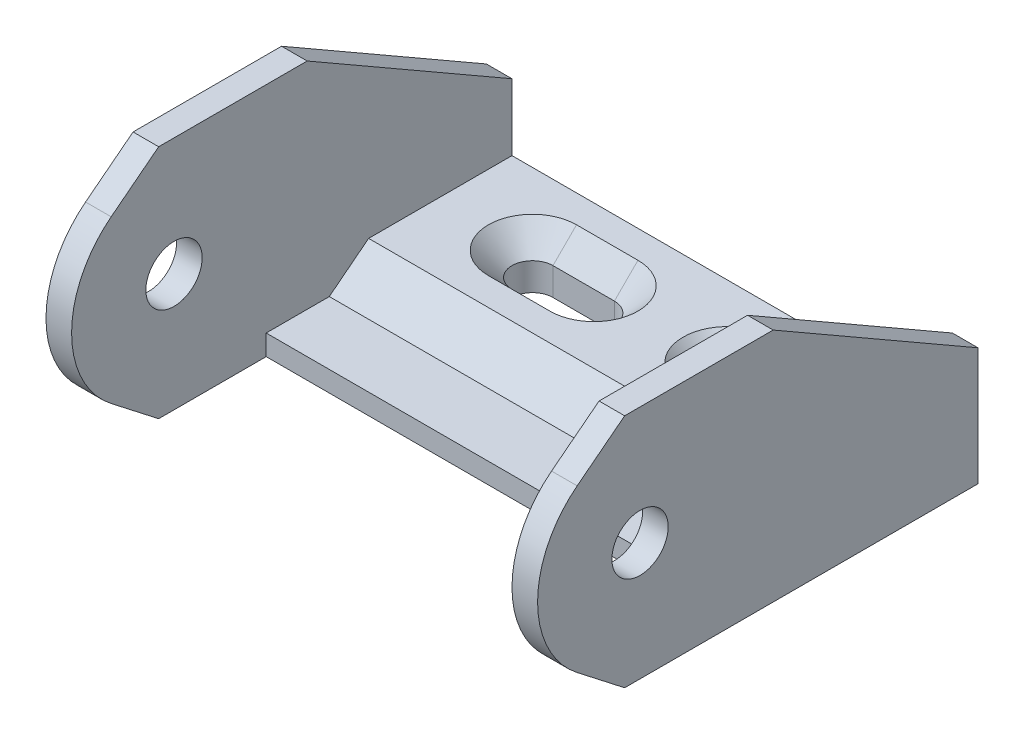
from build123d import *

# Parameters (mm, degrees)
BOSS_EXTRUDE1_DEPTH      = 24
SKETCH2_R                = 2.75
CUT_EXTRUDE1_DEPTH       = 48
CUT_EXTRUDE2_DEPTH       = 21.5
CUT_EXTRUDE3_DEPTH       = 40.535585237
CHAMFER1_SIZE            = 2.3
CHAMFER1_OF_MIRROR1_SIZE = 2.3


with BuildPart() as part:
    # Sketch1 → Boss-Extrude1 (new, symmetric)
    with BuildSketch(Plane(origin=(0, 0, 0), x_dir=(0, 0, -1), z_dir=(1, 0, 0))):
        with BuildLine():
            Line((-17.25, 11.5), (-21.887338715, 7.895129733))
            ThreePointArc((-21.887338715, 7.895129733), (-25.75, 0), (-21.887338715, -7.895129733))
            Line((-21.887338715, -7.895129733), (-17.25, -11.5))
            Line((-17.25, -11.5), (17.25, -11.5))
            Line((17.25, -11.5), (17.25, 11.5))
            Line((17.25, 11.5), (-17.25, 11.5))
        make_face()
    extrude(amount=BOSS_EXTRUDE1_DEPTH, both=True)

    # Sketch2 → Cut-Extrude1 (cut)
    with BuildSketch(Plane(origin=(24, 0, 0), x_dir=(0, 0, -1), z_dir=(1, 0, 0))):
        with Locations((-15.75, 0)):
            Circle(SKETCH2_R)
        Polygon((17.25, 0), (-2.75, 11.5), (17.25, 11.5), align=None)
    extrude(amount=-CUT_EXTRUDE1_DEPTH, mode=Mode.SUBTRACT)

    # Sketch4 → Cut-Extrude2 (cut, symmetric)
    with BuildSketch(Plane(origin=(0, 0, 0), x_dir=(0, 0, -1), z_dir=(1, 0, 0))):
        with BuildLine():
            Line((17.25, -6.5), (17.25, 0))
            Line((17.25, 0), (-2.75, 11.5))
            Line((-2.75, 11.5), (-17.25, 11.5))
            Line((-17.25, 11.5), (-21.887338715, 7.895129733))
            ThreePointArc((-21.887338715, 7.895129733), (-25.75, 0), (-21.887338715, -7.895129733))
            Line((-21.887338715, -7.895129733), (-17.25, -11.5))
            Line((-17.25, -11.5), (-6.75, -11.5))
            Line((-6.75, -11.5), (-6.75, -9.5))
            Line((-6.75, -9.5), (-0.589824897, -9.5))
            Line((-0.589824897, -9.5), (3.25, -6.5))
            Line((3.25, -6.5), (17.25, -6.5))
        make_face()
    extrude(amount=CUT_EXTRUDE2_DEPTH, both=True, mode=Mode.SUBTRACT)

    # Sketch5 → Cut-Extrude3 (cut, through all)
    with BuildSketch(Plane(origin=(0, -6.5, 0), x_dir=(1, 0, 0), z_dir=(0, 1, 0))):
        with BuildLine():
            Line((6.5, 12.25), (12.5, 12.25))
            ThreePointArc((12.5, 12.25), (14.5, 10.25), (12.5, 8.25))
            Line((12.5, 8.25), (6.5, 8.25))
            ThreePointArc((6.5, 8.25), (4.5, 10.25), (6.5, 12.25))
        make_face()
    cut_extrude3 = extrude(amount=-CUT_EXTRUDE3_DEPTH, mode=Mode.SUBTRACT)

    # Chamfer1
    chamfer1_edges = [part.edges().sort_by_distance(p)[0] for p in [
        (4.5, -6.5, -10.25),
        (9.5, -6.5, -8.25),
        (14.5, -6.5, -10.25),
        (9.5, -6.5, -12.25),
    ]]
    chamfer(chamfer1_edges, length=CHAMFER1_SIZE)

    # Mirror1: Cut-Extrude3 across plane
    add(cut_extrude3.mirror(Plane(origin=(0, 0, 0), x_dir=(0, 0, 1), z_dir=(1, 0, 0))), mode=Mode.SUBTRACT)

    # Chamfer1 of Mirror1
    chamfer1_of_mirror1_edges = [part.edges().sort_by_distance(p)[0] for p in [
        (-4.5, -6.5, -10.25),
        (-9.5, -6.5, -8.25),
        (-14.5, -6.5, -10.25),
        (-9.5, -6.5, -12.25),
    ]]
    chamfer(chamfer1_of_mirror1_edges, length=CHAMFER1_OF_MIRROR1_SIZE)


solid = part.part
